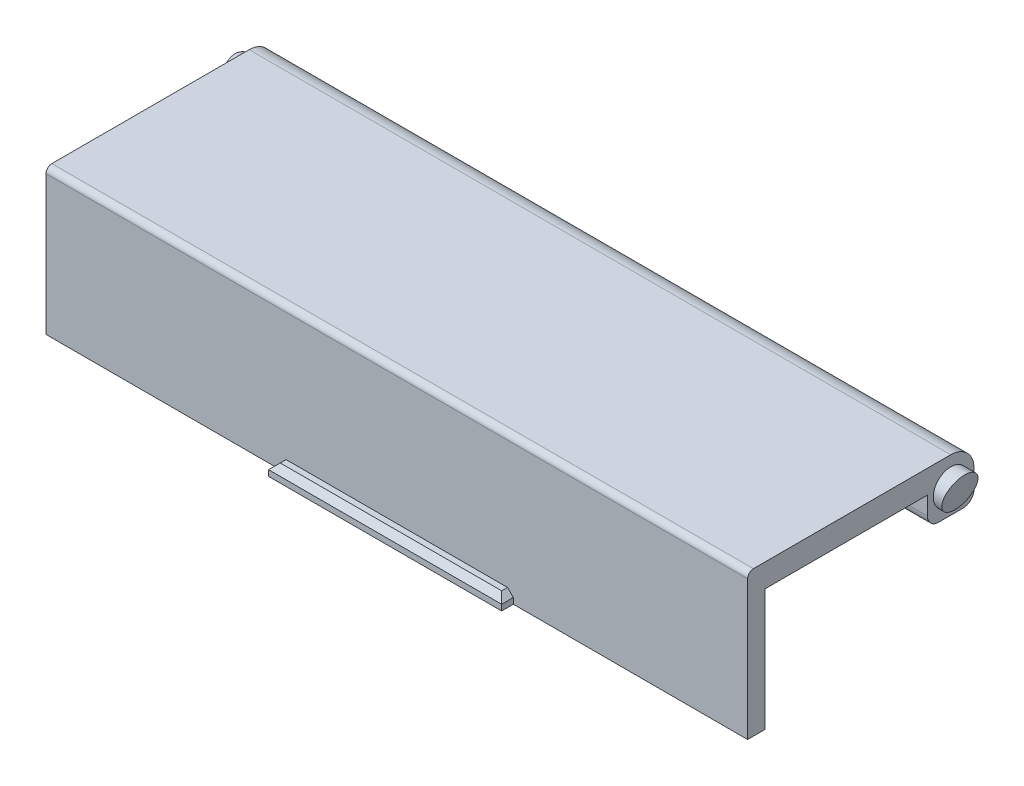
from build123d import *

# Parameters (mm, degrees)
BOSS_EXTRUDE1_DEPTH     = 30.099
FILLET1_R               = 2
SKETCH2_W               = 1
SKETCH2_H               = 1
BOSS_EXTRUDE2_DEPTH     = 10
SKETCH3_R               = 1.5
BOSS_EXTRUDE3_DEPTH     = 1.2
CHAMFER1_SIZE           = 0.5
FILLET3_R               = 0.5
FILLET4_R               = 0.9525
CUT_EXTRUDE2_DEPTH      = 39.292428468
CUT_EXTRUDE2_DEPTH_BACK = 39.292428468


with BuildPart() as part:
    # Sketch1 → Boss-Extrude1 (new, symmetric)
    with BuildSketch(Plane(origin=(0, 0, 0), x_dir=(0, 0, -1), z_dir=(1, 0, 0))):
        Polygon((0, -10.446), (0, 0), (13.931, 0), (13.931, -2.5), (17.931, -2.5), (17.931, 2), (-1.5, 2), (-1.5, -10.446), align=None)
    extrude(amount=BOSS_EXTRUDE1_DEPTH, both=True)

    # Fillet1
    fillet1_edges = [part.edges().sort_by_distance(p)[0] for p in [
        (0, 2, -17.931),
    ]]
    fillet(fillet1_edges, radius=FILLET1_R)

    # Sketch2 → Boss-Extrude2 (add, symmetric)
    with BuildSketch(Plane(origin=(0, 0, 0), x_dir=(0, 0, -1), z_dir=(1, 0, 0))):
        with Locations((-2, -9.946)):
            Rectangle(SKETCH2_W, SKETCH2_H)
    extrude(amount=BOSS_EXTRUDE2_DEPTH, both=True)

    # Sketch3 → Boss-Extrude3 (add)
    with BuildSketch(Plane(origin=(30.099, 0, 0), x_dir=(0, 0, -1), z_dir=(1, 0, 0))):
        with Locations((15.931, -0.4)):
            Circle(SKETCH3_R)
    boss_extrude3 = extrude(amount=BOSS_EXTRUDE3_DEPTH)

    # Mirror1: Boss-Extrude3 across plane
    add(boss_extrude3.mirror(Plane(origin=(0, 0, 0), x_dir=(0, 0, 1), z_dir=(1, 0, 0))))

    # Chamfer1
    chamfer1_edges = [part.edges().sort_by_distance(p)[0] for p in [
        (-10, -9.446, 2),
        (10, -9.446, 2),
        (0, -9.446, 2.5),
    ]]
    chamfer(chamfer1_edges, length=CHAMFER1_SIZE)

    # Fillet3
    fillet3_edges = [part.edges().sort_by_distance(p)[0] for p in [
        (0, 2, 1.5),
    ]]
    fillet(fillet3_edges, radius=FILLET3_R)

    # Fillet4
    fillet4_edges = [part.edges().sort_by_distance(p)[0] for p in [
        (0, -2.5, -13.931),
        (0, -2.5, -17.931),
    ]]
    fillet(fillet4_edges, radius=FILLET4_R)

    # Sketch8 → Cut-Extrude2 (cut, two sides: drawn at the far end of the back side and taken through both)
    with BuildSketch(Plane.XY.offset(1.5).offset(-CUT_EXTRUDE2_DEPTH_BACK)):
        Polygon((30.466401846, -1.9), (31.299, 1.1), (31.299, -1.9), align=None)
        Polygon((-31.299, -1.9), (-30.466401846, -1.9), (-31.299, 1.1), align=None)
    extrude(amount=CUT_EXTRUDE2_DEPTH + CUT_EXTRUDE2_DEPTH_BACK, mode=Mode.SUBTRACT)


solid = part.part
